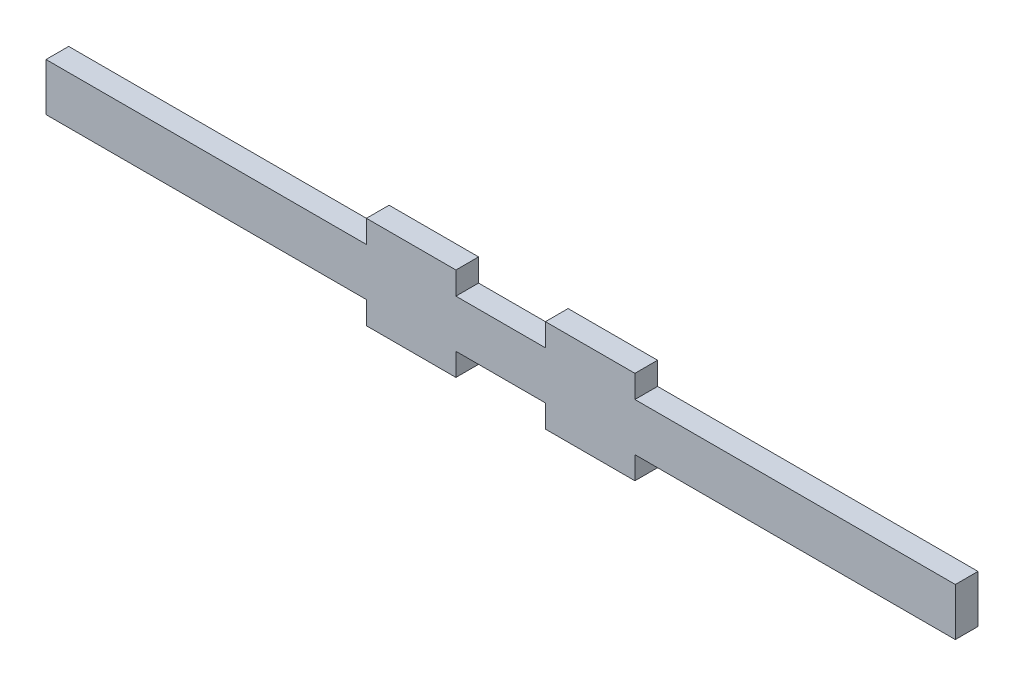
from build123d import *

# Parameters (mm, degrees)
SKETCH1_W   = 193.548
SKETCH1_H   = 19.812
BASE_DEPTH  = 4.826
SKETCH2_W   = 68.199
SKETCH2_H   = 4.826
SKETCH2_W_2 = 19.05
TABS_DEPTH  = 195.619202352


with BuildPart() as part:
    # Sketch1 → Base (new body)
    with BuildSketch(Plane.XY):
        with Locations((96.774, 9.906)):
            Rectangle(SKETCH1_W, SKETCH1_H)
    extrude(amount=BASE_DEPTH)

    # Sketch2 → Tabs (cut, through all)
    with BuildSketch(Plane.XY.offset(4.826)):
        with Locations((34.0995, 17.399)):
            Rectangle(SKETCH2_W, SKETCH2_H)
        with Locations((159.4485, 17.399)):
            Rectangle(SKETCH2_W, SKETCH2_H)
        with Locations((96.774, 17.399)):
            Rectangle(SKETCH2_W_2, SKETCH2_H)
        with Locations((96.774, 2.413)):
            Rectangle(SKETCH2_W_2, SKETCH2_H)
        with Locations((159.4485, 2.413)):
            Rectangle(SKETCH2_W, SKETCH2_H)
        with Locations((34.0995, 2.413)):
            Rectangle(SKETCH2_W, SKETCH2_H)
    extrude(amount=-TABS_DEPTH, mode=Mode.SUBTRACT)


solid = part.part
